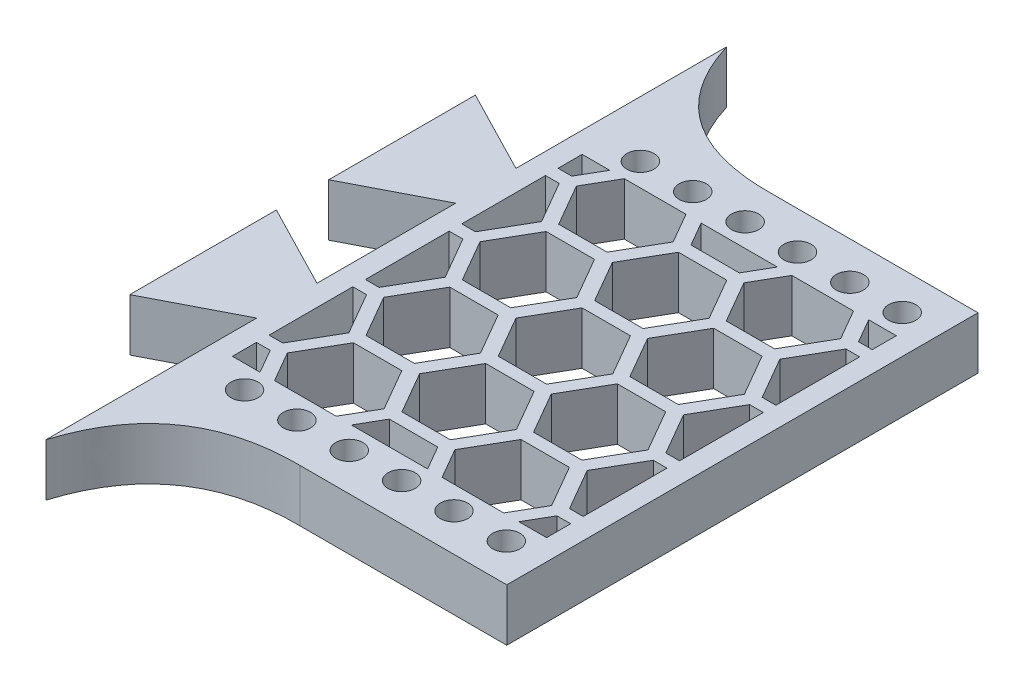
from build123d import *

# Parameters (mm, degrees)
SKETCH1_W           = 43.18
SKETCH1_H           = 57.15
BOSS_EXTRUDE1_DEPTH = 6.35
SKETCH2_R           = 1.651
CUT_EXTRUDE1_DEPTH  = 53.459609614
CUT_EXTRUDE2_DEPTH  = 53.459609614


with BuildPart() as part:
    # Sketch1 → Boss-Extrude1 (new body)
    with BuildSketch(Plane(origin=(0, 0, 0), x_dir=(1, 0, 0), z_dir=(0, 1, 0))):
        Polygon((-31.75, -20.955), (-21.59, -15.718655855), (-21.59, -8.411344145), (-31.75, -3.175), align=None)
        Rectangle(SKETCH1_W, SKETCH1_H)
        Polygon((-31.75, 3.175), (-21.59, 8.411344145), (-21.59, 15.718655855), (-31.75, 20.955), align=None)
        with BuildLine():
            Line((-4.218626538, -28.575), (-21.59, -28.575))
            Line((-21.59, -28.575), (-21.59, -41.275))
            add(Edge.make_bspline(
                [(-21.59, -41.275), (-17.723032693, -28.747286936), (-4.218626538, -28.575)],
                knots=[0, 0, 0, 0.972868199, 0.972868199, 0.972868199], degree=2))
        make_face()
        with BuildLine():
            Line((-21.59, 41.275), (-21.59, 28.575))
            Line((-21.59, 28.575), (-4.218626538, 28.575))
            add(Edge.make_bspline(
                [(-21.59, 41.275), (-17.723032693, 28.747286936), (-4.218626538, 28.575)],
                knots=[0, 0, 0, 0.972868199, 0.972868199, 0.972868199], degree=2))
        make_face()
    extrude(amount=BOSS_EXTRUDE1_DEPTH)

    # Sketch2 → Cut-Extrude1 (cut, through all)
    with BuildSketch(Plane(origin=(0, 6.35, 0), x_dir=(1, 0, 0), z_dir=(0, 1, 0))):
        with Locations(Location((4.2672, 24.003, 0), (0, 0, 270))):
            Circle(SKETCH2_R)
        with Locations(Location((4.2672, -24.003, 0), (0, 0, 270))):
            Circle(SKETCH2_R)
        with Locations(Location((10.6172, 24.003, 0), (0, 0, 270))):
            Circle(SKETCH2_R)
        with Locations(Location((10.6172, -24.003, 0), (0, 0, 270))):
            Circle(SKETCH2_R)
        with Locations(Location((16.9672, 24.003, 0), (0, 0, 270))):
            Circle(SKETCH2_R)
        with Locations(Location((16.9672, -24.003, 0), (0, 0, 270))):
            Circle(SKETCH2_R)
        with Locations(Location((-2.0828, 24.003, 0), (0, 0, 270))):
            Circle(SKETCH2_R)
        with Locations(Location((-2.0828, -24.003, 0), (0, 0, 270))):
            Circle(SKETCH2_R)
        with Locations(Location((-8.4328, 24.003, 0), (0, 0, 270))):
            Circle(SKETCH2_R)
        with Locations(Location((-8.4328, -24.003, 0), (0, 0, 270))):
            Circle(SKETCH2_R)
        with Locations(Location((-14.7828, 24.003, 0), (0, 0, 270))):
            Circle(SKETCH2_R)
        with Locations(Location((-14.7828, -24.003, 0), (0, 0, 270))):
            Circle(SKETCH2_R)
    extrude(amount=-CUT_EXTRUDE1_DEPTH, mode=Mode.SUBTRACT)

    # Sketch3 → Cut-Extrude2 (cut, through all)
    with BuildSketch(Plane(origin=(0, 6.35, 0), x_dir=(1, 0, 0), z_dir=(0, 1, 0))):
        Polygon((-17.387060633, 18.288), (-15.700620496, 21.209), (-19.05, 21.209), (-19.05, 18.288), align=None)
        Polygon((-4.335480447, 17.526), (-6.461861489, 21.209), (-13.940856876, 21.209), (-16.067237917, 17.526), (-13.13429855, 12.446), (-7.268419815, 12.446), align=None)
        Polygon((-17.387060633, 16.764), (-19.05, 16.764), (-19.05, 6.604), (-17.387060633, 6.604), (-14.454121265, 11.684), align=None)
        Polygon((-16.067237917, 5.842), (-13.13429855, 0.762), (-7.268419815, 0.762), (-4.335480447, 5.842), (-7.268419815, 10.922), (-13.13429855, 10.922), align=None)
        Polygon((-17.387060633, 5.08), (-19.05, 5.08), (-19.05, -5.08), (-17.387060633, -5.08), (-14.454121265, 0), align=None)
        Polygon((-16.067237917, -5.842), (-13.13429855, -10.922), (-7.268419815, -10.922), (-4.335480447, -5.842), (-7.268419815, -0.762), (-13.13429855, -0.762), align=None)
        Polygon((-19.05, -6.604), (-19.05, -16.764), (-17.387060633, -16.764), (-14.454121265, -11.684), (-17.387060633, -6.604), align=None)
        Polygon((-13.940856876, -21.209), (-6.461861489, -21.209), (-4.335480447, -17.526), (-7.268419815, -12.446), (-13.13429855, -12.446), (-16.067237917, -17.526), align=None)
        Polygon((-19.05, -21.209), (-15.700620496, -21.209), (-17.387060633, -18.288), (-19.05, -18.288), align=None)
        Polygon((-4.619379504, -21.209), (4.619379504, -21.209), (2.932939367, -18.288), (-2.932939367, -18.288), align=None)
        Polygon((-2.932939367, -16.764), (2.932939367, -16.764), (5.865878735, -11.684), (2.932939367, -6.604), (-2.932939367, -6.604), (-5.865878735, -11.684), align=None)
        Polygon((-2.932939367, -5.08), (2.932939367, -5.08), (5.865878735, 0), (2.932939367, 5.08), (-2.932939367, 5.08), (-5.865878735, 0), align=None)
        Polygon((-2.932939367, 6.604), (2.932939367, 6.604), (5.865878735, 11.684), (2.932939367, 16.764), (-2.932939367, 16.764), (-5.865878735, 11.684), align=None)
        Polygon((2.932939367, 18.288), (4.619379504, 21.209), (-4.619379504, 21.209), (-2.932939367, 18.288), align=None)
        Polygon((15.984519553, 17.526), (13.858138511, 21.209), (6.379143124, 21.209), (4.252762083, 17.526), (7.18570145, 12.446), (13.051580185, 12.446), align=None)
        Polygon((17.387060633, 18.288), (19.05, 18.288), (19.05, 21.209), (15.700620496, 21.209), align=None)
        Polygon((17.387060633, 6.604), (19.05, 6.604), (19.05, 16.764), (17.387060633, 16.764), (14.454121265, 11.684), align=None)
        Polygon((4.252762083, 5.842), (7.18570145, 0.762), (13.051580185, 0.762), (15.984519553, 5.842), (13.051580185, 10.922), (7.18570145, 10.922), align=None)
        Polygon((19.05, -5.08), (19.05, 5.08), (17.387060633, 5.08), (14.454121265, 0), (17.387060633, -5.08), align=None)
        Polygon((4.252762083, -5.842), (7.18570145, -10.922), (13.051580185, -10.922), (15.984519553, -5.842), (13.051580185, -0.762), (7.18570145, -0.762), align=None)
        Polygon((19.05, -16.764), (19.05, -6.604), (17.387060633, -6.604), (14.454121265, -11.684), (17.387060633, -16.764), align=None)
        Polygon((6.379143124, -21.209), (13.858138511, -21.209), (15.984519553, -17.526), (13.051580185, -12.446), (7.18570145, -12.446), (4.252762083, -17.526), align=None)
        Polygon((19.05, -21.209), (19.05, -18.288), (17.387060633, -18.288), (15.700620496, -21.209), align=None)
    extrude(amount=-CUT_EXTRUDE2_DEPTH, mode=Mode.SUBTRACT)


solid = part.part
